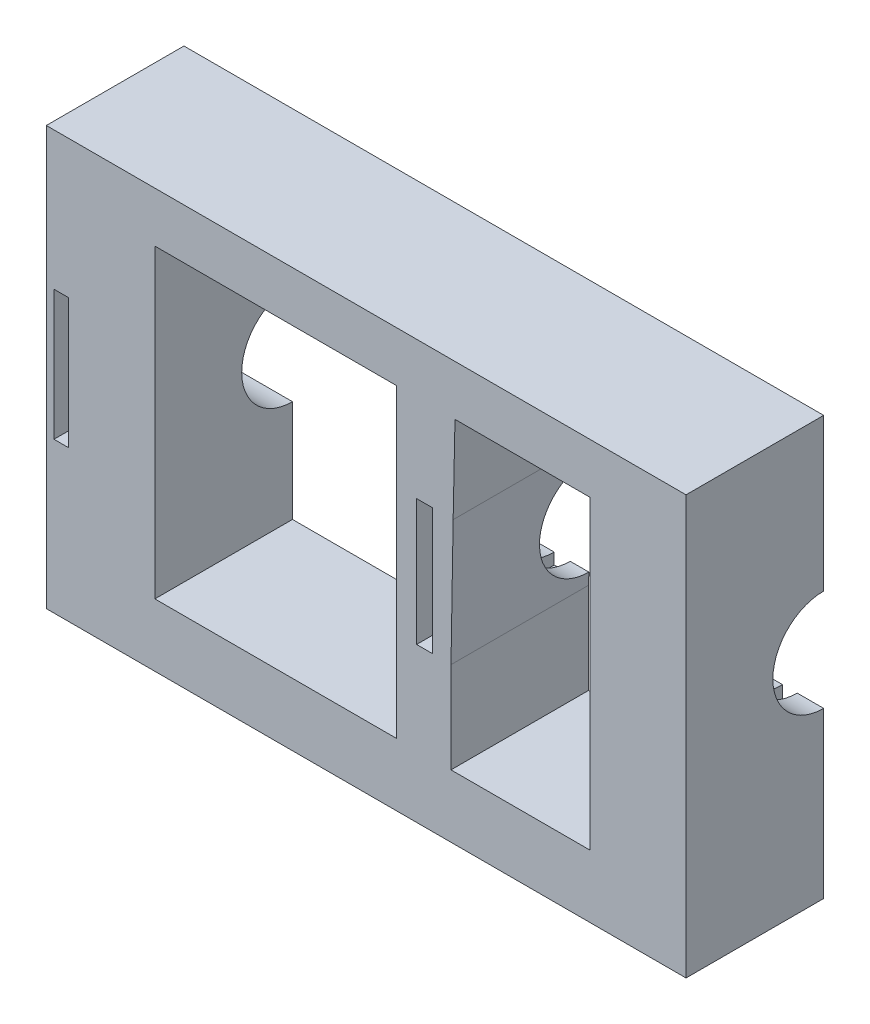
from build123d import *

# Parameters (mm, degrees)
BOSS_EXTRUDE1_DEPTH     = 13.1572
BOSS_EXTRUDE2_DEPTH     = 8.89
SKETCH3_W               = 66.04
SKETCH3_H               = 20.285187831
BOSS_EXTRUDE3_DEPTH     = 5.08
BOSS_EXTRUDE4_DEPTH     = 8.89
CUT_EXTRUDE1_DEPTH      = 64.71104446
CUT_EXTRUDE1_DEPTH_BACK = 64.71104446
SKETCH6_R               = 5.1435
SKETCH7_W               = 66.04
SKETCH7_H               = 20.285187831
BOSS_EXTRUDE5_DEPTH     = 25.4
SKETCH9_W               = 1.615391333
SKETCH9_H               = 12.791830428
BOSS_EXTRUDE6_DEPTH     = 19.05
SKETCH10_R              = 5.08
CUT_EXTRUDE2_DEPTH      = 15.24
CUT_EXTRUDE3_DEPTH      = 1.27
SKETCH14_W              = 1.4732
SKETCH14_H              = 13.1572
CUT_EXTRUDE4_DEPTH      = 15.24
SKETCH15_W              = 64.77
SKETCH15_H              = 20.285187831
CUT_EXTRUDE5_DEPTH      = 19.05
BOSS_EXTRUDE7_DEPTH     = 1.4986
SKETCH17_W              = 64.77
SKETCH17_H              = 42.3672
CUT_EXTRUDE7_DEPTH      = 6.35


with BuildPart() as part:
    # Sketch1 → Boss-Extrude1 (new body)
    with BuildSketch(Plane(origin=(0, 0, 0), x_dir=(1, 0, 0), z_dir=(0, 1, 0))):
        Polygon((3.949839476, 3.210057439), (3.949839476, 17.1069), (0, 17.1069), (0, 0), (0, -3.178287831), (66.04, -3.178287831), (66.04, 0), (66.04, 17.1069), (62.090160524, 17.1069), (62.090160524, 3.210057439), (60.616960524, 3.210057439), (60.616960524, 17.1069), (55.050578368, 17.1069), (55.050578368, 3.210057439), (55.050578368, 0), (10.989421632, 0), (10.989421632, 3.210057439), (10.989421632, 17.1069), (5.423039476, 17.1069), (5.423039476, 3.210057439), align=None)
    extrude(amount=BOSS_EXTRUDE1_DEPTH)

    # Sketch2 → Boss-Extrude2 (add)
    with BuildSketch(Plane(origin=(0, 13.1572, 0), x_dir=(1, 0, 0), z_dir=(0, 1, 0))):
        Polygon((10.989421632, 17.1069), (0, 17.1069), (0, -3.178287831), (66.04, -3.178287831), (66.04, 17.1069), (55.050578368, 17.1069), (55.050578368, -0.226283794), (10.989421632, 0), align=None)
    extrude(amount=BOSS_EXTRUDE2_DEPTH)

    # Sketch3 → Boss-Extrude3 (add)
    with BuildSketch(Plane(origin=(0, 22.0472, 0), x_dir=(1, 0, 0), z_dir=(0, 1, 0))):
        with Locations((33.02, 6.964306084)):
            Rectangle(SKETCH3_W, SKETCH3_H)
    extrude(amount=BOSS_EXTRUDE3_DEPTH)

    # Sketch4 → Boss-Extrude4 (add)
    with BuildSketch(Plane.XZ):
        Polygon((66.04, -17.1069), (55.050578368, -17.1069), (55.050578368, 0), (10.989421632, 0), (10.989421632, -17.1069), (0, -17.1069), (0, 3.178287831), (66.04, 3.178287831), align=None)
    extrude(amount=BOSS_EXTRUDE4_DEPTH)

    # Sketch6 → Cut-Extrude1 (cut, two sides: drawn at the far end of the back side and taken through both)
    with BuildSketch(Plane.ZY.offset(-55.050578368).offset(-CUT_EXTRUDE1_DEPTH_BACK)):
        with Locations((-17.1069, 6.5786)):
            Circle(SKETCH6_R)
    extrude(amount=CUT_EXTRUDE1_DEPTH + CUT_EXTRUDE1_DEPTH_BACK, mode=Mode.SUBTRACT)

    # Sketch7 → Boss-Extrude5 (add)
    with BuildSketch(Plane.XZ.offset(8.89)):
        with Locations((33.02, -6.964306084)):
            Rectangle(SKETCH7_W, SKETCH7_H)
    extrude(amount=BOSS_EXTRUDE5_DEPTH)

    # Sketch9 → Boss-Extrude6 (add)
    with BuildSketch(Plane(origin=(0, 0, -17.1069), x_dir=(-1, 0, 0), z_dir=(0, 0, -1))):
        Polygon((-41.375896334, 22.0472), (-41.18906329, 13.1572), (-40.971249817, 0.333691876), (-40.971249817, -8.89), (-37.490871957, -8.89), (-35.458871957, -8.89), (-35.458871957, 13.1572), (-35.458871957, 22.0472), align=None)
        with Locations((-38.298567624, 6.761284786)):
            Rectangle(SKETCH9_W, SKETCH9_H, mode=Mode.SUBTRACT)
    extrude(amount=-BOSS_EXTRUDE6_DEPTH)

    # Sketch10 → Cut-Extrude2 (cut)
    with BuildSketch(Plane.ZY.offset(-35.458871957)):
        with Locations((-17.1069, 6.5786)):
            Circle(SKETCH10_R)
    extrude(amount=-CUT_EXTRUDE2_DEPTH, mode=Mode.SUBTRACT)

    # Sketch12 → Cut-Extrude3 (cut)
    with BuildSketch(Plane(origin=(66.04, 0, 0), x_dir=(0, 0, -1), z_dir=(1, 0, 0))):
        Polygon((17.1069, 27.1272), (17.1069, 11.7221), (17.1069, 1.4351), (17.1069, -34.29), (-3.178287831, -34.29), (-3.52610715, 27.1272), align=None)
    extrude(amount=-CUT_EXTRUDE3_DEPTH, mode=Mode.SUBTRACT)

    # Sketch14 → Cut-Extrude4 (cut)
    with BuildSketch(Plane(origin=(0, 0, -17.1069), x_dir=(-1, 0, 0), z_dir=(0, 0, -1))):
        with Locations((-4.686439476, 6.5786)):
            Rectangle(SKETCH14_W, SKETCH14_H)
        with Locations((-1.511439476, 6.5786)):
            Rectangle(SKETCH14_W, SKETCH14_H)
    extrude(amount=-CUT_EXTRUDE4_DEPTH, mode=Mode.SUBTRACT)

    # Sketch15 → Cut-Extrude5 (cut)
    with BuildSketch(Plane.XZ.offset(34.29)):
        with Locations((32.385, -6.964306084)):
            Rectangle(SKETCH15_W, SKETCH15_H)
    extrude(amount=-CUT_EXTRUDE5_DEPTH, mode=Mode.SUBTRACT)

    # Sketch16 → Boss-Extrude7 (add)
    with BuildSketch(Plane.ZY.offset(-5.423039476)):
        with BuildLine():
            Line((-17.1069, 13.1572), (6.075816752, 13.1572))
            Line((6.075816752, 13.1572), (6.075816752, 0))
            Line((6.075816752, 0), (-17.1069, 0))
            Line((-17.1069, 0), (-17.1069, 1.4351))
            ThreePointArc((-17.1069, 1.4351), (-11.9634, 6.5786), (-17.1069, 11.7221))
            Line((-17.1069, 11.7221), (-17.1069, 13.1572))
        make_face()
    extrude(amount=BOSS_EXTRUDE7_DEPTH)

    # Sketch17 → Cut-Extrude7 (cut)
    with BuildSketch(Plane.XY.offset(3.178287831)):
        with Locations((32.385, 5.9436)):
            Rectangle(SKETCH17_W, SKETCH17_H)
    extrude(amount=-CUT_EXTRUDE7_DEPTH, mode=Mode.SUBTRACT)


with BuildPart() as body_2:
    # of the pieces the cut leaves, the one that is kept (cut_extrude7_keep)
    add(part.part.solids().sort_by_distance((10.989421632, 11.7221, -17.1069))[0])


solid = body_2.part
